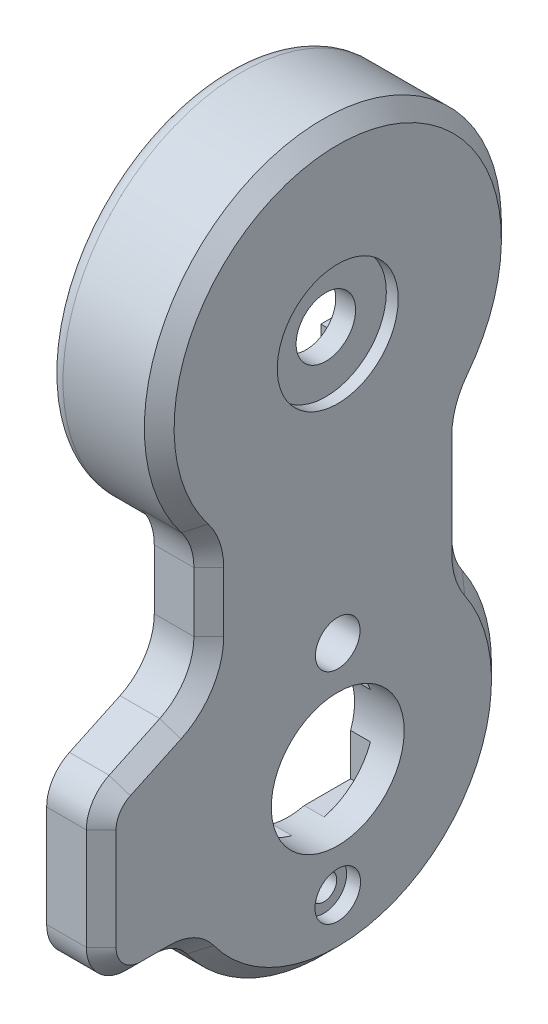
from build123d import *
from build123d.topology import SkipClean

# Parameters (mm, degrees)
BOSS_EXTRUDE1_START  = 55.1
BOSS_EXTRUDE1_DEPTH  = 5.5
BOSS_EXTRUDE2_START  = 55
BOSS_EXTRUDE2_DEPTH  = 0.6
BOSS_EXTRUDE3_START  = 49.4
SKETCH3_R            = 18
SKETCH3_R_2          = 16.3
BOSS_EXTRUDE3_DEPTH  = 6.2
CHAMFER1_SIZE        = 1.5
FILLET1_R            = 1.5
BOSS_EXTRUDE4_START  = 62.7
SKETCH4_W            = 2.3
SKETCH4_H            = 23
BOSS_EXTRUDE4_DEPTH  = 6.6
BOSS_EXTRUDE5_START  = 54.5
SKETCH5_W            = 2.3
SKETCH5_H            = 6.6
BOSS_EXTRUDE5_DEPTH  = 23
BOSS_EXTRUDE6_START  = 55.1
SKETCH6_R            = 4.6
BOSS_EXTRUDE6_DEPTH  = 2.3
BOSS_EXTRUDE7_START  = 59.4
SKETCH7_R            = 6.1
BOSS_EXTRUDE7_DEPTH  = 1.7
BOSS_EXTRUDE8_START  = 57.3
SKETCH8_R            = 3
BOSS_EXTRUDE8_DEPTH  = 2.2
BOSS_EXTRUDE9_START  = 65.1
SKETCH9_W            = 2.3
SKETCH9_H            = 3.4
BOSS_EXTRUDE9_DEPTH  = 1.8
BOSS_EXTRUDE10_START = 72.6
SKETCH10_W           = 2.3
SKETCH10_H           = 1.8
BOSS_EXTRUDE10_DEPTH = 3.4
BOSS_EXTRUDE11_START = 65.1
SKETCH11_W           = 2.3
SKETCH11_H           = 3.4
BOSS_EXTRUDE11_DEPTH = 1.8
BOSS_EXTRUDE12_START = 56
SKETCH12_W           = 2.3
SKETCH12_H           = 1.8
BOSS_EXTRUDE12_DEPTH = 3.4
BOSS_EXTRUDE13_START = 62
SKETCH13_W           = 6.3
SKETCH13_H           = 3.098418
BOSS_EXTRUDE13_DEPTH = 8
BOSS_EXTRUDE14_START = 55.875
SKETCH14_W           = 4.1
SKETCH14_H           = 2
BOSS_EXTRUDE14_DEPTH = 2.9
BOSS_EXTRUDE15_START = 84.025
SKETCH15_W           = 4.1
SKETCH15_H           = 2
BOSS_EXTRUDE15_DEPTH = 2.9
BOSS_EXTRUDE16_START = 59.7
SKETCH16_W           = 2.1
SKETCH16_H           = 13
BOSS_EXTRUDE16_DEPTH = 23.4
BOSS_EXTRUDE17_START = 55.5
SKETCH17_R           = 6.7
BOSS_EXTRUDE17_DEPTH = 5.6
BOSS_EXTRUDE18_START = 55.5
SKETCH18_R           = 2.25
BOSS_EXTRUDE18_DEPTH = 5.6
BOSS_EXTRUDE19_START = 59.2
SKETCH19_R           = 2.3
BOSS_EXTRUDE19_DEPTH = 1.9
BOSS_EXTRUDE20_START = 55.5
SKETCH20_R           = 1.3
BOSS_EXTRUDE20_DEPTH = 3.75
BOSS_EXTRUDE21_START = 56.4
SKETCH21_W           = 3.1
SKETCH21_H           = 4.1
BOSS_EXTRUDE21_DEPTH = 2.2
BOSS_EXTRUDE22_START = -5.75
BOSS_EXTRUDE22_DEPTH = 3.5
BOSS_EXTRUDE23_START = 73.4
SKETCH23_W           = 3.1
SKETCH23_H           = 4.1
BOSS_EXTRUDE23_DEPTH = 2.2
BOSS_EXTRUDE24_START = -5.75
BOSS_EXTRUDE24_DEPTH = 3.5


with BuildPart() as part:
    # Sketch1 → Boss-Extrude1 (new body)
    with BuildSketch(Plane(origin=(0, 0, 0), x_dir=(0, 0, -1), z_dir=(1, 0, 0)).offset(BOSS_EXTRUDE1_START)):
        with BuildLine():
            Line((-53, 3.337122), (-53, -7.038519))
            ThreePointArc((-53, -7.038519), (-52.733199, -8.807822), (-51.956522, -10.419775))
            ThreePointArc((-51.956522, -10.419775), (-56.189506, -33.883595), (-79.719936, -30.038095))
            ThreePointArc((-79.719936, -30.038095), (-81.138131, -28.832955), (-82.948156, -28.4))
            Line((-82.948156, -28.4), (-85.85, -28.4))
            ThreePointArc((-85.85, -28.4), (-88.678427, -27.228427), (-89.85, -24.4))
            Line((-89.85, -24.4), (-89.85, -14.139668))
            ThreePointArc((-89.85, -14.139668), (-89.226857, -11.995644), (-87.551581, -10.519637))
            Line((-87.551581, -10.519637), (-82.447628, -8.120544))
            ThreePointArc((-82.447628, -8.120544), (-79.934715, -5.906534), (-79, -2.690498))
            Line((-79, -2.690498), (-79, 3.337122))
            ThreePointArc((-79, 3.337122), (-79.321092, 5.273613), (-80.25, 7.002841))
            ThreePointArc((-80.25, 7.002841), (-66, 36), (-51.75, 7.002841))
            ThreePointArc((-51.75, 7.002841), (-52.678908, 5.273613), (-53, 3.337122))
        make_face()
    extrude(amount=BOSS_EXTRUDE1_DEPTH)


with BuildPart() as body_2:
    # Sketch2 → Boss-Extrude2 (new body)
    with BuildSketch(Plane(origin=(0, 0, 0), x_dir=(0, 0, -1), z_dir=(1, 0, 0)).offset(BOSS_EXTRUDE2_START)):
        with BuildLine():
            Line((-53.8, 3.337122), (-53.8, -7.038519))
            ThreePointArc((-53.8, -7.038519), (-53.497625, -9.043729), (-52.617391, -10.870609))
            ThreePointArc((-52.617391, -10.870609), (-56.651176, -33.230249), (-79.074292, -29.565714))
            ThreePointArc((-79.074292, -29.565714), (-80.776126, -28.119546), (-82.948156, -27.6))
            Line((-82.948156, -27.6), (-85.85, -27.6))
            ThreePointArc((-85.85, -27.6), (-88.112742, -26.662742), (-89.05, -24.4))
            Line((-89.05, -24.4), (-89.05, -14.139668))
            ThreePointArc((-89.05, -14.139668), (-88.551486, -12.424449), (-87.211265, -11.243643))
            Line((-87.211265, -11.243643), (-82.107312, -8.84455))
            ThreePointArc((-82.107312, -8.84455), (-79.259343, -6.335339), (-78.2, -2.690498))
            Line((-78.2, -2.690498), (-78.2, 3.337122))
            ThreePointArc((-78.2, 3.337122), (-78.563904, 5.531812), (-79.616667, 7.491604))
            ThreePointArc((-79.616667, 7.491604), (-66, 35.2), (-52.383333, 7.491604))
            ThreePointArc((-52.383333, 7.491604), (-53.436096, 5.531812), (-53.8, 3.337122))
        make_face()
    extrude(amount=BOSS_EXTRUDE2_DEPTH)


with BuildPart() as part_1:
    add(part.part)

    # Combine1: cut body 2
    add(body_2.part, mode=Mode.SUBTRACT)

    # Sketch3 → Boss-Extrude3 (add)
    with BuildSketch(Plane(origin=(0, 0, 0), x_dir=(0, 0, -1), z_dir=(1, 0, 0)).offset(BOSS_EXTRUDE3_START)):
        with Locations((-66, 18)):
            Circle(SKETCH3_R)
        with Locations((-66, 18)):
            Circle(SKETCH3_R_2, mode=Mode.SUBTRACT)
    extrude(amount=BOSS_EXTRUDE3_DEPTH)

    # Chamfer1
    chamfer1_edges = [part_1.edges().sort_by_distance(p)[0] for p in [
        (60.6, -5.906534, 79.934715),
        (60.6, -9.320091, 84.999605),
        (60.6, 0.323312, 79),
        (60.6, -11.995644, 89.226857),
        (60.6, 5.273613, 79.321092),
        (60.6, -19.269834, 89.85),
        (60.6, 36, 66),
        (60.6, -27.228427, 88.678427),
        (60.6, 5.273613, 52.678908),
        (60.6, -28.4, 84.399078),
        (60.6, -1.850698, 53),
        (60.6, -28.832955, 81.138131),
        (60.6, -8.807822, 52.733199),
        (60.6, -33.883595, 56.189506),
    ]]
    chamfer(chamfer1_edges, length=CHAMFER1_SIZE)

    # Fillet1
    fillet1_edges = [part_1.edges().sort_by_distance(p)[0] for p in [
        (49.4, 18, 84),
    ]]
    fillet(fillet1_edges, radius=FILLET1_R)


with BuildPart() as body_2_2:
    # Sketch4 → Boss-Extrude4 (new body)
    with BuildSketch(Plane.XY.offset(BOSS_EXTRUDE4_START)):
        with Locations((56.25, 18)):
            Rectangle(SKETCH4_W, SKETCH4_H)
    extrude(amount=BOSS_EXTRUDE4_DEPTH)


with BuildPart() as part_2:
    add(part_1.part)

    # Combine2: cut body 2 2
    add(body_2_2.part, mode=Mode.SUBTRACT)


with BuildPart() as body_2_3:
    # Sketch5 → Boss-Extrude5 (new body)
    with BuildSketch(Plane.XY.offset(BOSS_EXTRUDE5_START)):
        with Locations((56.25, 18)):
            Rectangle(SKETCH5_W, SKETCH5_H)
    extrude(amount=BOSS_EXTRUDE5_DEPTH)


with BuildPart() as part_3:
    add(part_2.part)

    # Combine3: cut body 2 3
    add(body_2_3.part, mode=Mode.SUBTRACT)


with BuildPart() as body_2_4:
    # Sketch6 → Boss-Extrude6 (new body)
    with BuildSketch(Plane(origin=(0, 0, 0), x_dir=(0, 0, -1), z_dir=(1, 0, 0)).offset(BOSS_EXTRUDE6_START)):
        with Locations((-66, 18)):
            Circle(SKETCH6_R)
    extrude(amount=BOSS_EXTRUDE6_DEPTH)


with BuildPart() as part_4:
    add(part_3.part)

    # Combine4: cut body 2 4
    add(body_2_4.part, mode=Mode.SUBTRACT)


with BuildPart() as body_2_5:
    # Sketch7 → Boss-Extrude7 (new body)
    with BuildSketch(Plane(origin=(0, 0, 0), x_dir=(0, 0, -1), z_dir=(1, 0, 0)).offset(BOSS_EXTRUDE7_START)):
        with Locations((-66, 18)):
            Circle(SKETCH7_R)
    extrude(amount=BOSS_EXTRUDE7_DEPTH)


with BuildPart() as part_5:
    add(part_4.part)

    # Combine5: cut body 2 5
    add(body_2_5.part, mode=Mode.SUBTRACT)


with BuildPart() as body_2_6:
    # Sketch8 → Boss-Extrude8 (new body)
    with BuildSketch(Plane(origin=(0, 0, 0), x_dir=(0, 0, -1), z_dir=(1, 0, 0)).offset(BOSS_EXTRUDE8_START)):
        with Locations((-66, 18)):
            Circle(SKETCH8_R)
    extrude(amount=BOSS_EXTRUDE8_DEPTH)


with BuildPart() as part_6:
    add(part_5.part)

    # Combine6: cut body 2 6
    add(body_2_6.part, mode=Mode.SUBTRACT)


with BuildPart() as body_2_7:
    # Sketch9 → Boss-Extrude9 (new body)
    with BuildSketch(Plane.XY.offset(BOSS_EXTRUDE9_START)):
        with Locations((58.45, 26.3)):
            Rectangle(SKETCH9_W, SKETCH9_H)
    extrude(amount=BOSS_EXTRUDE9_DEPTH)


with BuildPart() as part_7:
    add(part_6.part)

    # Combine7: cut body 2 7
    add(body_2_7.part, mode=Mode.SUBTRACT)


with BuildPart() as body_2_8:
    # Sketch10 → Boss-Extrude10 (new body)
    with BuildSketch(Plane.XY.offset(BOSS_EXTRUDE10_START)):
        with Locations((58.45, 18)):
            Rectangle(SKETCH10_W, SKETCH10_H)
    extrude(amount=BOSS_EXTRUDE10_DEPTH)


with BuildPart() as part_8:
    add(part_7.part)

    # Combine8: cut body 2 8
    add(body_2_8.part, mode=Mode.SUBTRACT)


with BuildPart() as body_2_9:
    # Sketch11 → Boss-Extrude11 (new body)
    with BuildSketch(Plane.XY.offset(BOSS_EXTRUDE11_START)):
        with Locations((58.45, 9.7)):
            Rectangle(SKETCH11_W, SKETCH11_H)
    extrude(amount=BOSS_EXTRUDE11_DEPTH)


with BuildPart() as part_9:
    add(part_8.part)

    # Combine9: cut body 2 9
    add(body_2_9.part, mode=Mode.SUBTRACT)


with BuildPart() as body_2_10:
    # Sketch12 → Boss-Extrude12 (new body)
    with BuildSketch(Plane.XY.offset(BOSS_EXTRUDE12_START)):
        with Locations((58.45, 18)):
            Rectangle(SKETCH12_W, SKETCH12_H)
    extrude(amount=BOSS_EXTRUDE12_DEPTH)


with BuildPart() as part_10:
    add(part_9.part)

    # Combine10: cut body 2 10
    add(body_2_10.part, mode=Mode.SUBTRACT)


with BuildPart() as body_2_11:
    # Sketch13 → Boss-Extrude13 (new body)
    with BuildSketch(Plane.XY.offset(BOSS_EXTRUDE13_START)):
        with Locations((52.45, 0.949209)):
            Rectangle(SKETCH13_W, SKETCH13_H)
    extrude(amount=BOSS_EXTRUDE13_DEPTH)


with BuildPart() as part_11:
    add(part_10.part)

    # Combine11: cut body 2 11
    add(body_2_11.part, mode=Mode.SUBTRACT)


with BuildPart() as body_2_12:
    # Sketch14 → Boss-Extrude14 (new body)
    with BuildSketch(Plane.XY.offset(BOSS_EXTRUDE14_START)):
        with Locations((57.55, -20)):
            Rectangle(SKETCH14_W, SKETCH14_H)
    extrude(amount=BOSS_EXTRUDE14_DEPTH)


with BuildPart() as part_12:
    add(part_11.part)

    # Combine12: cut body 2 12
    add(body_2_12.part, mode=Mode.SUBTRACT)


with BuildPart() as body_2_13:
    # Sketch15 → Boss-Extrude15 (new body)
    with BuildSketch(Plane.XY.offset(BOSS_EXTRUDE15_START)):
        with Locations((57.55, -20)):
            Rectangle(SKETCH15_W, SKETCH15_H)
    extrude(amount=BOSS_EXTRUDE15_DEPTH)


with BuildPart() as part_13:
    add(part_12.part)

    # Combine13: cut body 2 13
    add(body_2_13.part, mode=Mode.SUBTRACT)


with BuildPart() as body_2_14:
    # Sketch16 → Boss-Extrude16 (new body)
    with BuildSketch(Plane.XY.offset(BOSS_EXTRUDE16_START)):
        with Locations((56.55, -20)):
            Rectangle(SKETCH16_W, SKETCH16_H)
    extrude(amount=BOSS_EXTRUDE16_DEPTH)


with BuildPart() as part_14:
    add(part_13.part)

    # Combine14: cut body 2 14
    add(body_2_14.part, mode=Mode.SUBTRACT)


with BuildPart() as body_2_15:
    # Sketch17 → Boss-Extrude17 (new body)
    with BuildSketch(Plane(origin=(0, 0, 0), x_dir=(0, 0, -1), z_dir=(1, 0, 0)).offset(BOSS_EXTRUDE17_START)):
        with Locations((-66, -20)):
            Circle(SKETCH17_R)
    extrude(amount=BOSS_EXTRUDE17_DEPTH)


with BuildPart() as part_15:
    add(part_14.part)

    # Combine15: cut body 2 15
    add(body_2_15.part, mode=Mode.SUBTRACT)


with BuildPart() as body_2_16:
    # Sketch18 → Boss-Extrude18 (new body)
    with BuildSketch(Plane(origin=(0, 0, 0), x_dir=(0, 0, -1), z_dir=(1, 0, 0)).offset(BOSS_EXTRUDE18_START)):
        with Locations((-66, -9)):
            Circle(SKETCH18_R)
    extrude(amount=BOSS_EXTRUDE18_DEPTH)


with BuildPart() as part_16:
    add(part_15.part)

    # Combine16: cut body 2 16
    add(body_2_16.part, mode=Mode.SUBTRACT)


with BuildPart() as body_2_17:
    # Sketch19 → Boss-Extrude19 (new body)
    with BuildSketch(Plane(origin=(0, 0, 0), x_dir=(0, 0, -1), z_dir=(1, 0, 0)).offset(BOSS_EXTRUDE19_START)):
        with Locations((-66, -31)):
            Circle(SKETCH19_R)
    extrude(amount=BOSS_EXTRUDE19_DEPTH)


with BuildPart() as part_17:
    add(part_16.part)

    # Combine17: cut body 2 17
    add(body_2_17.part, mode=Mode.SUBTRACT)


with BuildPart() as body_2_18:
    # Sketch20 → Boss-Extrude20 (new body)
    with BuildSketch(Plane(origin=(0, 0, 0), x_dir=(0, 0, -1), z_dir=(1, 0, 0)).offset(BOSS_EXTRUDE20_START)):
        with Locations((-66, -31)):
            Circle(SKETCH20_R)
    extrude(amount=BOSS_EXTRUDE20_DEPTH)


with BuildPart() as part_18:
    add(part_17.part)

    # Combine18: cut body 2 18
    add(body_2_18.part, mode=Mode.SUBTRACT)


with BuildPart() as body_2_19:
    # Sketch21 → Boss-Extrude21 (new body)
    with BuildSketch(Plane.XY.offset(BOSS_EXTRUDE21_START)):
        with Locations((57.05, -4)):
            Rectangle(SKETCH21_W, SKETCH21_H)
    extrude(amount=BOSS_EXTRUDE21_DEPTH)


with BuildPart() as part_19:
    add(part_18.part)

    # Combine19: cut body 2 19
    add(body_2_19.part, mode=Mode.SUBTRACT)

    # Sketch22 → Boss-Extrude22 (add)
    with SkipClean():  # the faces are left unmerged after this step: merging them gives an invalid solid
        with BuildSketch(Plane(origin=(0, 0, 0), x_dir=(1, 0, 0), z_dir=(0, 1, 0)).offset(BOSS_EXTRUDE22_START)):
            Polygon((58.8, -58), (58.8, -57), (52.8, -57), (52.8, -56.6), (52.2, -56.6), (51.4, -57.4), (51.4, -58), align=None)
        extrude(amount=BOSS_EXTRUDE22_DEPTH)


with BuildPart() as body_2_20:
    # Sketch23 → Boss-Extrude23 (new body)
    with BuildSketch(Plane.XY.offset(BOSS_EXTRUDE23_START)):
        with Locations((57.05, -4)):
            Rectangle(SKETCH23_W, SKETCH23_H)
    extrude(amount=BOSS_EXTRUDE23_DEPTH)


with BuildPart() as part_20:
    add(part_19.part)

    # Combine20: cut body 2 20
    add(body_2_20.part, mode=Mode.SUBTRACT)

    # Sketch24 → Boss-Extrude24 (add)
    with SkipClean():  # the faces are left unmerged after this step: merging them gives an invalid solid
        with BuildSketch(Plane(origin=(0, 0, 0), x_dir=(1, 0, 0), z_dir=(0, 1, 0)).offset(BOSS_EXTRUDE24_START)):
            Polygon((58.8, -74), (58.8, -75), (52.8, -75), (52.8, -75.4), (52.2, -75.4), (51.4, -74.6), (51.4, -74), align=None)
        extrude(amount=BOSS_EXTRUDE24_DEPTH)


solid = part_20.part
